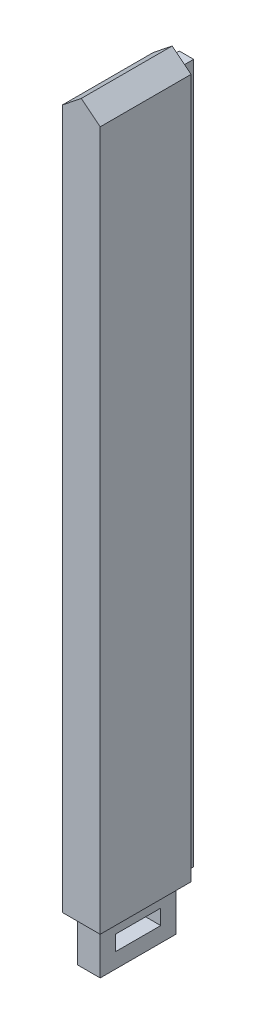
from build123d import *

# Parameters (mm, degrees)
EXTRUDE_1_DEPTH          = 12
EXTRUDE_2_DEPTH          = 1.9
SKETCH_3_W               = 3
SKETCH_3_H               = 10
EXTRUDE_3_DEPTH          = 6
CUT_EXTRUDE_1_DEPTH      = 100.209676947
CUT_EXTRUDE_1_DEPTH_BACK = 3
SKETCH_4_W               = 6
SKETCH_4_H               = 2


with BuildPart() as part:
    # 草图1 → 凸台-拉伸1 (new body)
    with BuildSketch(Plane.XY):
        Polygon((2.5, 1.997498436), (0, 0), (0, -92.4), (5, -92.4), (5, 0), align=None)
    extrude(amount=EXTRUDE_1_DEPTH)

    # 草图2 → 凸台-拉伸2 (add)
    with BuildSketch(Plane(origin=(0, 0, 0), x_dir=(-1, 0, 0), z_dir=(0, 0, -1))):
        Polygon((-1.55, 0), (-3.45, 0), (-3.45, -1.400450224), (-3.45, -92.4), (-1.55, -92.4), (-1.55, -1.477736038), align=None)
    extrude(amount=EXTRUDE_2_DEPTH)

    # 草图3 → 凸台-拉伸3 (add)
    with BuildSketch(Plane.XZ.offset(92.4)):
        with Locations((2.5, 6)):
            Rectangle(SKETCH_3_W, SKETCH_3_H)
    extrude(amount=EXTRUDE_3_DEPTH)

    # 草图4 → 切除-拉伸1 (cut, two sides: drawn at the far end of the back side and taken through both)
    with BuildSketch(Plane(origin=(4, 0, 0), x_dir=(0, 0, -1), z_dir=(1, 0, 0)).offset(-CUT_EXTRUDE_1_DEPTH_BACK)):
        with Locations((-6, -95.4)):
            Rectangle(SKETCH_4_W, SKETCH_4_H)
    extrude(amount=CUT_EXTRUDE_1_DEPTH + CUT_EXTRUDE_1_DEPTH_BACK, mode=Mode.SUBTRACT)


solid = part.part
